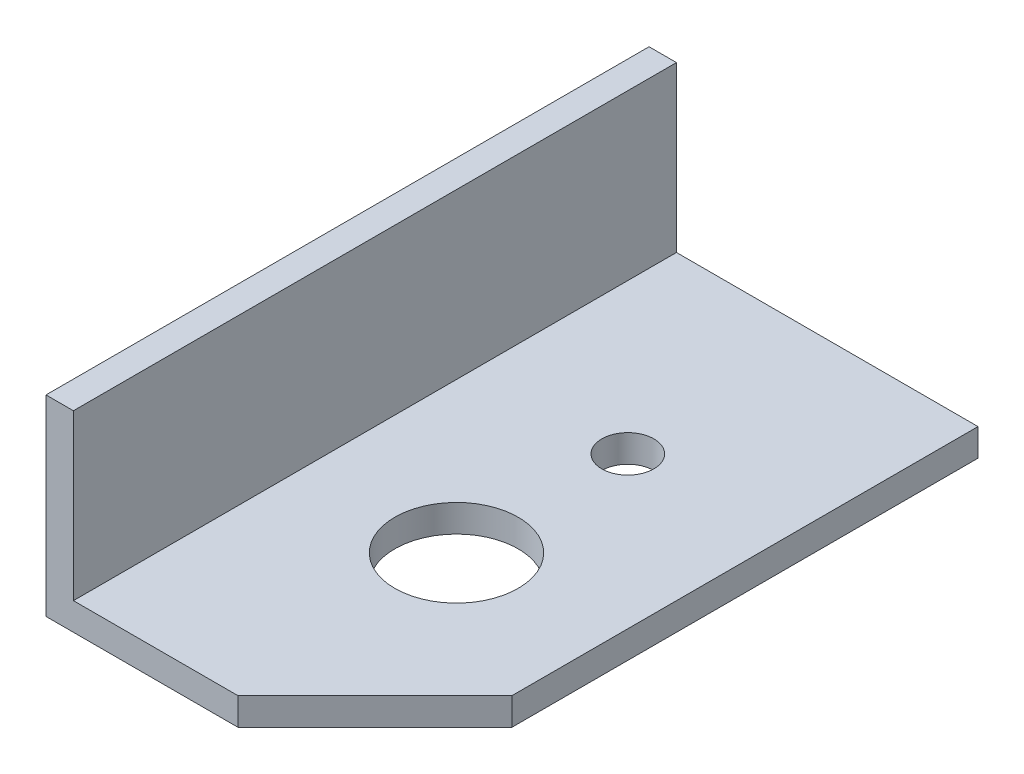
from build123d import *

# Parameters (mm, degrees)
EXTRUDE_1_DEPTH     = 44
SKETCH_4_R          = 1.9
SKETCH_4_R_2        = 4.5
CUT_EXTRUDE_1_DEPTH = 52.536394907
CHAMFER_1_SIZE      = 10


with BuildPart() as part:
    # Эскиз2 → Вытянуть-Тонкостенный1 (new body)
    with BuildSketch(Plane.XY):
        Polygon((24, 0), (0, 0), (0, 14), (2, 14), (2, 2), (24, 2), align=None)
    extrude(amount=EXTRUDE_1_DEPTH)

    # Эскиз4 → Вырез-Вытянуть1 (cut, through all)
    with BuildSketch(Plane(origin=(0, 2, 0), x_dir=(-1, 0, 0), z_dir=(0, 1, 0))):
        with Locations(Location((-12.95, 14.5, 0), (0, 0, 90))):
            Circle(SKETCH_4_R)
        with Locations(Location((-12.95, 27, 0), (0, 0, 90))):
            Circle(SKETCH_4_R_2)
    extrude(amount=-CUT_EXTRUDE_1_DEPTH, mode=Mode.SUBTRACT)

    # Фаска1
    chamfer_1_edges = [part.edges().sort_by_distance(p)[0] for p in [
        (24, 1, 44),
    ]]
    chamfer(chamfer_1_edges, length=CHAMFER_1_SIZE)


solid = part.part
